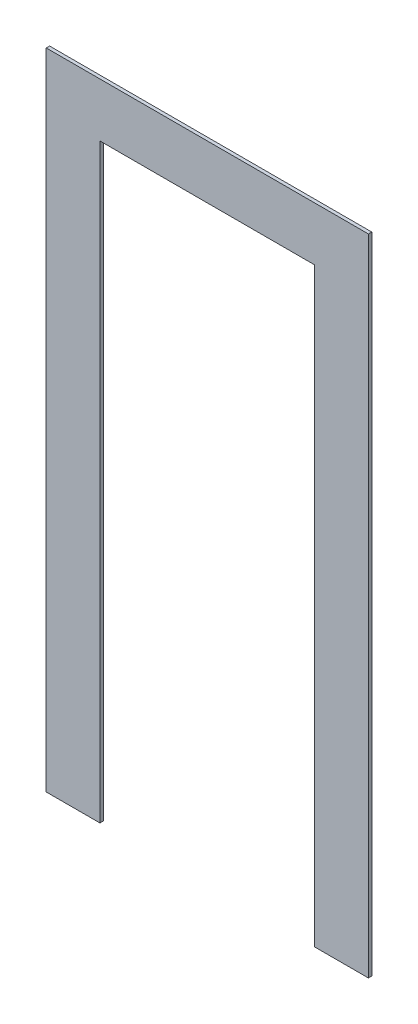
from build123d import *

# Parameters (mm, degrees)
SKETCH2_W           = 304.8
SKETCH2_H           = 609.6
BOSS_EXTRUDE1_DEPTH = 3.175
SKETCH3_W           = 203.2
SKETCH3_H           = 558.8
CUT_EXTRUDE1_DEPTH  = 3.175


with BuildPart() as part:
    # Sketch2 → Boss-Extrude1 (new body)
    with BuildSketch(Plane.XY):
        with Locations((152.4, 304.8)):
            Rectangle(SKETCH2_W, SKETCH2_H)
    extrude(amount=BOSS_EXTRUDE1_DEPTH)

    # Sketch3 → Cut-Extrude1 (cut)
    with BuildSketch(Plane.XY.offset(3.175)):
        with Locations((152.4, 279.4)):
            Rectangle(SKETCH3_W, SKETCH3_H)
    extrude(amount=-CUT_EXTRUDE1_DEPTH, mode=Mode.SUBTRACT)


solid = part.part
